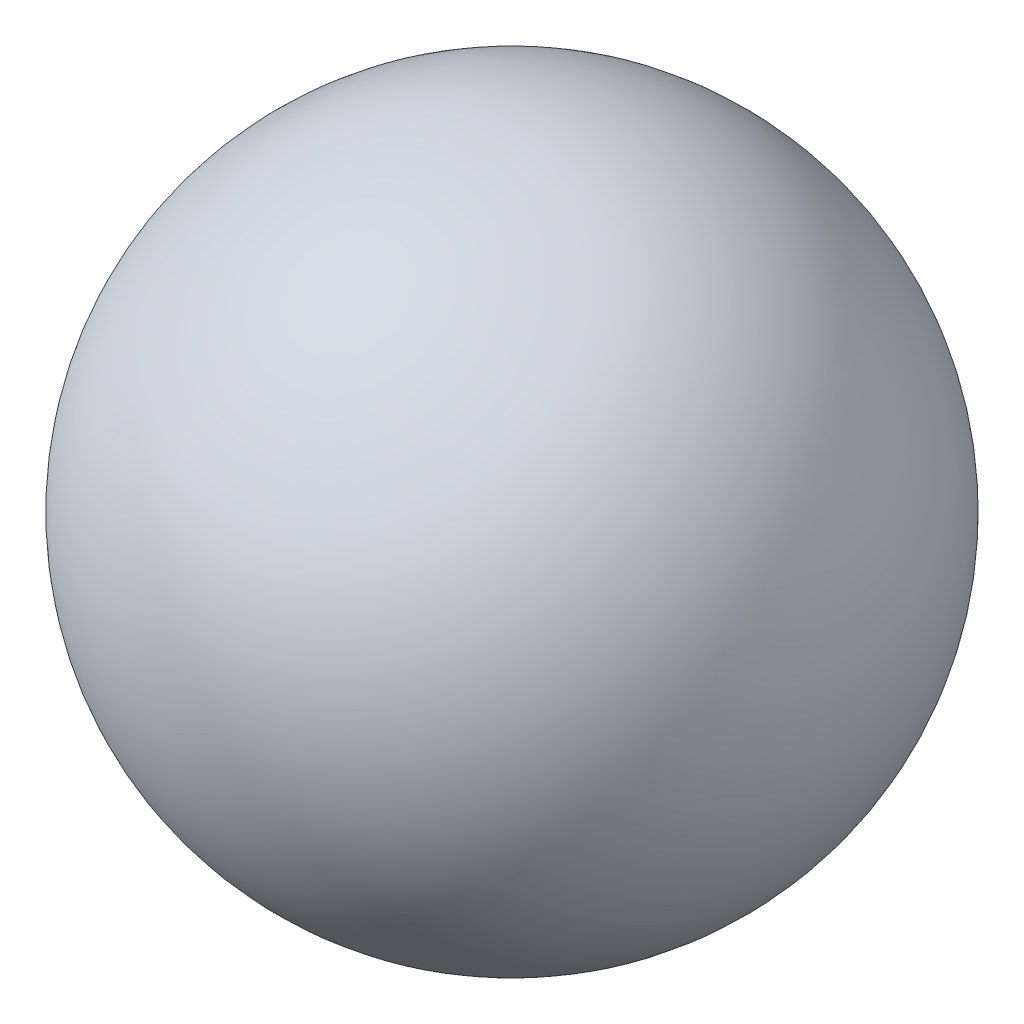
from build123d import *


with BuildPart() as part:
    # Sketch2 → Revolve6 (revolve)
    with BuildSketch(Plane.XY):
        with BuildLine():
            Line((0, 420), (0, 416.14))
            ThreePointArc((0, 416.14), (-416.14, 0), (0, -416.14))
            Line((0, -416.14), (0, -420))
            ThreePointArc((0, -420), (-420, 0), (0, 420))
        make_face()
    revolve(axis=Axis((0, -420, 0), (0, 1, 0)))


solid = part.part
